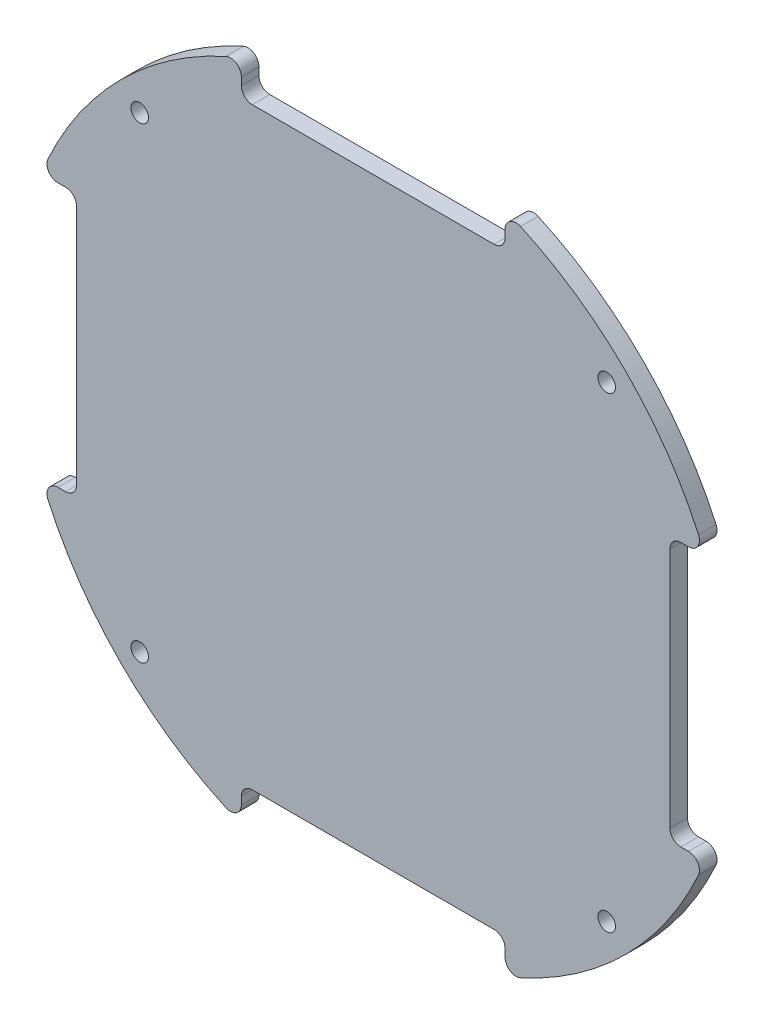
from build123d import *

# Parameters (mm, degrees)
SKETCH_1_R          = 32.5
EXTRUDE_1_DEPTH     = 1.6
SKETCH_2_W          = 24
SKETCH_2_H          = 5.5
SKETCH_2_W_2        = 5.5
SKETCH_2_H_2        = 24
CUT_EXTRUDE_1_DEPTH = 1.6
SKETCH_3_R          = 0.8
CUT_EXTRUDE_2_DEPTH = 1.6
FILLET_1_R          = 1


with BuildPart() as part:
    # 草图1 → 凸台-拉伸1 (new body)
    with BuildSketch(Plane.XY):
        Circle(SKETCH_1_R)
    extrude(amount=EXTRUDE_1_DEPTH)

    # 草图2 → 切除-拉伸1 (cut)
    with BuildSketch(Plane.XY):
        with Locations((0, -29.75)):
            Rectangle(SKETCH_2_W, SKETCH_2_H)
        with Locations((29.75, 0)):
            Rectangle(SKETCH_2_W_2, SKETCH_2_H_2)
        with Locations((-29.75, 0)):
            Rectangle(SKETCH_2_W_2, SKETCH_2_H_2)
        with Locations((0, 29.75)):
            Rectangle(SKETCH_2_W, SKETCH_2_H)
    extrude(amount=CUT_EXTRUDE_1_DEPTH, mode=Mode.SUBTRACT)

    # 草图3 → 切除-拉伸2 (cut)
    with BuildSketch(Plane.XY.offset(1.6)):
        with Locations((21.25, 21.25)):
            Circle(SKETCH_3_R)
        with Locations((21.25, -21.25)):
            Circle(SKETCH_3_R)
        with Locations((-21.25, -21.25)):
            Circle(SKETCH_3_R)
        with Locations((-21.25, 21.25)):
            Circle(SKETCH_3_R)
    extrude(amount=-CUT_EXTRUDE_2_DEPTH, mode=Mode.SUBTRACT)

    # 圆角1
    fillet_1_edges = [part.edges().sort_by_distance(p)[0] for p in [
        (27, -12, 0.8),
        (27, 12, 0.8),
        (30.203476621, -12, 0.8),
        (30.203476621, 12, 0.8),
        (-12, -27, 0.8),
        (12, -30.203476621, 0.8),
        (12, -27, 0.8),
        (-12, -30.203476621, 0.8),
        (-27, 12, 0.8),
        (-30.203476621, -12, 0.8),
        (-27, -12, 0.8),
        (-30.203476621, 12, 0.8),
        (12, 27, 0.8),
        (-12, 30.203476621, 0.8),
        (-12, 27, 0.8),
        (12, 30.203476621, 0.8),
    ]]
    fillet(fillet_1_edges, radius=FILLET_1_R)


solid = part.part
